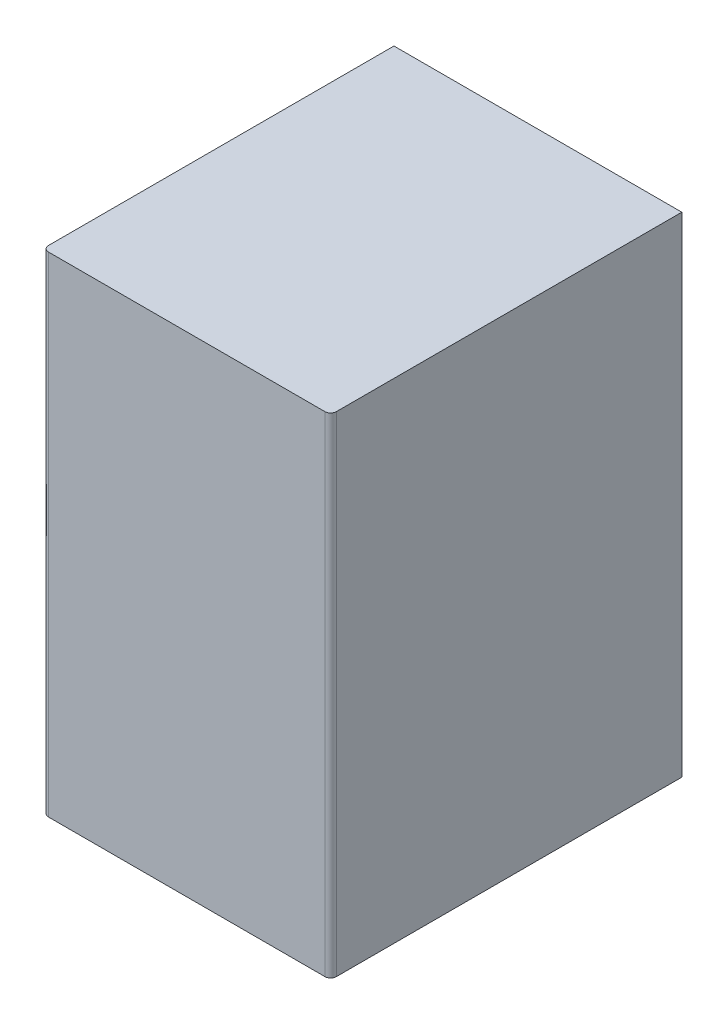
from build123d import *

# Parameters (mm, degrees)
SKETCH1_W           = 500
SKETCH1_H           = 610
BOSS_EXTRUDE1_DEPTH = 850
FILLET1_R           = 10


with BuildPart() as part:
    # Sketch1 → Boss-Extrude1 (new body)
    with BuildSketch(Plane(origin=(0, 0, 0), x_dir=(1, 0, 0), z_dir=(0, 1, 0))):
        Rectangle(SKETCH1_W, SKETCH1_H)
    extrude(amount=BOSS_EXTRUDE1_DEPTH)

    # Fillet1
    fillet1_edges = [part.edges().sort_by_distance(p)[0] for p in [
        (250, 425, 305),
        (-250, 425, 305),
    ]]
    fillet(fillet1_edges, radius=FILLET1_R)


solid = part.part
